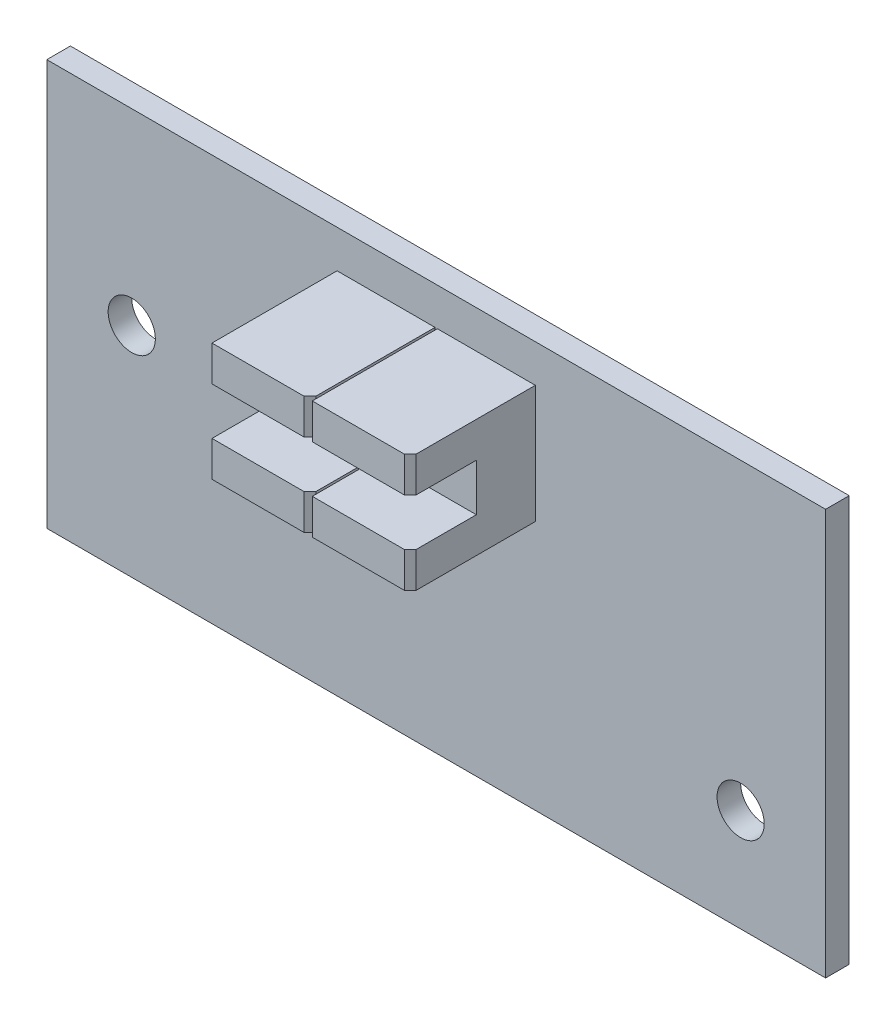
from build123d import *

# Parameters (mm, degrees)
CROQUIS1_W              = 33
CROQUIS1_H              = 17.2
CROQUIS1_R              = 1
SALIENTE_EXTRUIR1_DEPTH = 1
CROQUIS2_W              = 8.4
CROQUIS2_H              = 5
SALIENTE_EXTRUIR2_DEPTH = 2.5
CROQUIS2_5_W            = 8.4
CROQUIS2_5_H            = 1.5
SALIENTE_EXTRUIR3_DEPTH = 5.3
CORTAR_EXTRUIR1_START   = -5.3
CROQUIS3_W              = 0.1
CROQUIS3_H              = 5
CORTAR_EXTRUIR1_DEPTH   = 5.3
CHAFL_N1_SIZE           = 0.25


with BuildPart() as part:
    # Croquis1 → Saliente-Extruir1 (new body)
    with BuildSketch(Plane.XY):
        Rectangle(CROQUIS1_W, CROQUIS1_H)
        with Locations((-12.9, 0.65)):
            Circle(CROQUIS1_R, mode=Mode.SUBTRACT)
        with Locations((12.9, -4.25)):
            Circle(CROQUIS1_R, mode=Mode.SUBTRACT)
    extrude(amount=SALIENTE_EXTRUIR1_DEPTH)

    # Croquis2 → Saliente-Extruir2 (add)
    with BuildSketch(Plane.XY.offset(1)):
        with Locations((0, 4.5)):
            Rectangle(CROQUIS2_W, CROQUIS2_H)
    extrude(amount=SALIENTE_EXTRUIR2_DEPTH)

    # Croquis2<5> → Saliente-Extruir3 (add)
    with BuildSketch(Plane.XY.offset(1)):
        with Locations((0, 2.75)):
            Rectangle(CROQUIS2_5_W, CROQUIS2_5_H)
        with Locations((0, 6.25)):
            Rectangle(CROQUIS2_5_W, CROQUIS2_5_H)
    extrude(amount=SALIENTE_EXTRUIR3_DEPTH)

    # Croquis3 → Cortar-Extruir1 (cut)
    with BuildSketch(Plane.XY.offset(6.3).offset(CORTAR_EXTRUIR1_START)):
        with Locations((0, 4.5)):
            Rectangle(CROQUIS3_W, CROQUIS3_H)
    extrude(amount=CORTAR_EXTRUIR1_DEPTH, mode=Mode.SUBTRACT)

    # Chaflán1
    chafl_n1_edges = [part.edges().sort_by_distance(p)[0] for p in [
        (4.2, 2.75, 6.3),
        (4.2, 6.25, 6.3),
        (-0.05, 2.75, 6.3),
        (-0.05, 6.25, 6.3),
    ]]
    chamfer(chafl_n1_edges, length=CHAFL_N1_SIZE)


solid = part.part
